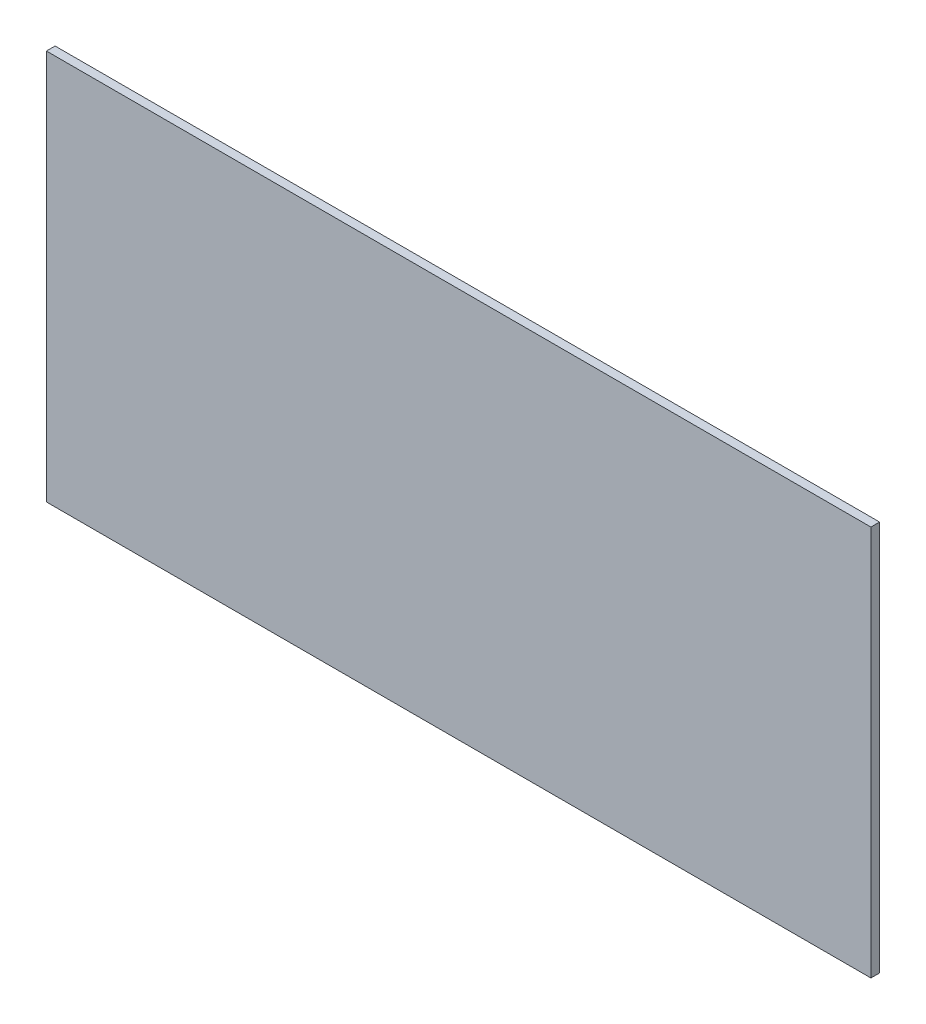
from build123d import *

# Parameters (mm, degrees)
SKETCH1_W     = 190
SKETCH1_H     = 90
PROFILE_DEPTH = 2


with BuildPart() as part:
    # Sketch1 → Profile (new body)
    with BuildSketch(Plane.XY):
        with Locations((95, 45)):
            Rectangle(SKETCH1_W, SKETCH1_H)
    extrude(amount=PROFILE_DEPTH)


solid = part.part
